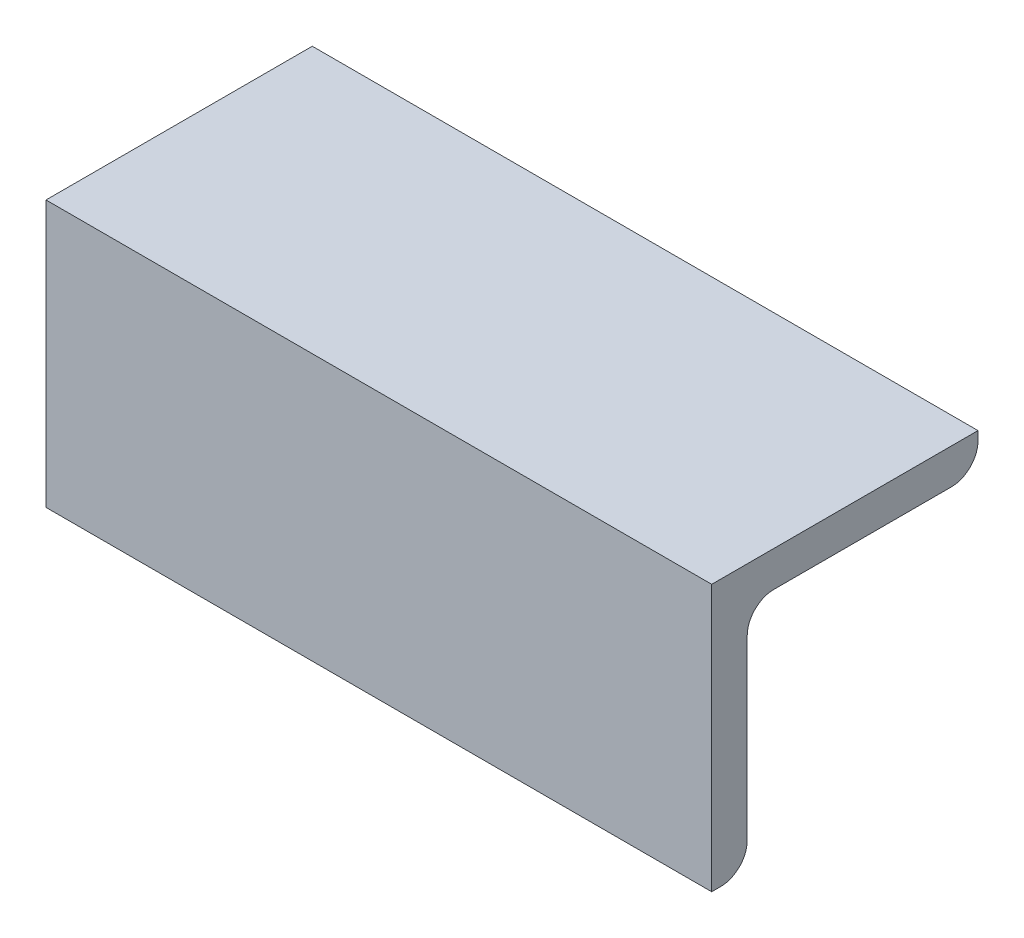
from build123d import *

# Parameters (mm, degrees)
BOSS_EXTRUDE1_DEPTH = 75


with BuildPart() as part:
    # Sketch1 → Boss-Extrude1 (new body)
    with BuildSketch(Plane(origin=(0, 0, 0), x_dir=(0, 0, -1), z_dir=(1, 0, 0))):
        with BuildLine():
            Line((0, 16.28959276), (-30, 16.28959276))
            Line((-30, 16.28959276), (-30, -13.71040724))
            Line((-30, -13.71040724), (-29, -13.71040724))
            ThreePointArc((-29, -13.71040724), (-26.878679656, -12.831727583), (-26, -10.71040724))
            Line((-26, -10.71040724), (-26, 9.28959276))
            ThreePointArc((-26, 9.28959276), (-25.121320344, 11.410913104), (-23, 12.28959276))
            Line((-23, 12.28959276), (-3, 12.28959276))
            ThreePointArc((-3, 12.28959276), (-0.878679656, 13.168272417), (0, 15.28959276))
            Line((0, 15.28959276), (0, 16.28959276))
        make_face()
    extrude(amount=BOSS_EXTRUDE1_DEPTH)


solid = part.part
